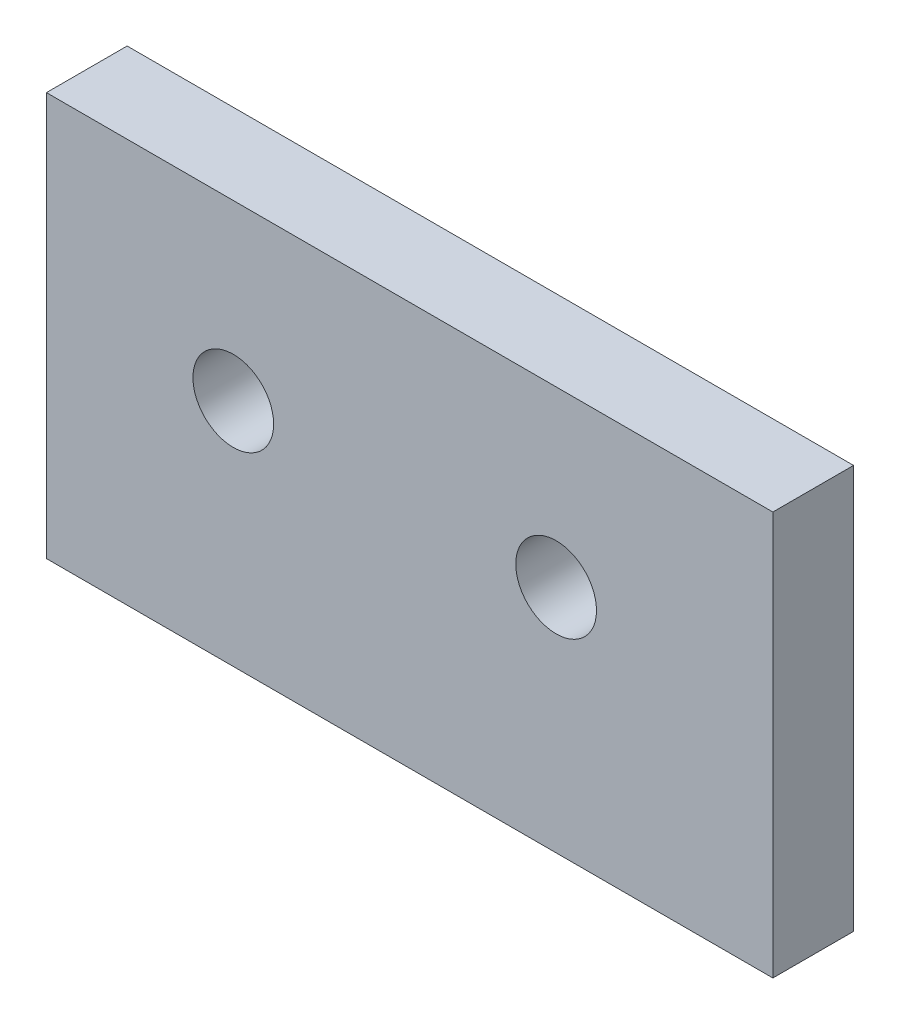
from build123d import *

# Parameters (mm, degrees)
SZKIC1_W                    = 90
SZKIC1_H                    = 50
SZKIC1_R                    = 5
DODANIE_WYCI_GNI_CIE1_DEPTH = 10


with BuildPart() as part:
    # Szkic1 → Dodanie-wyciągnięcie1 (new body)
    with BuildSketch(Plane.XY):
        with Locations((45, 25)):
            Rectangle(SZKIC1_W, SZKIC1_H)
        with Locations((23.15, 28.5)):
            Circle(SZKIC1_R, mode=Mode.SUBTRACT)
        with Locations((63.15, 28.5)):
            Circle(SZKIC1_R, mode=Mode.SUBTRACT)
    extrude(amount=DODANIE_WYCI_GNI_CIE1_DEPTH)


solid = part.part
